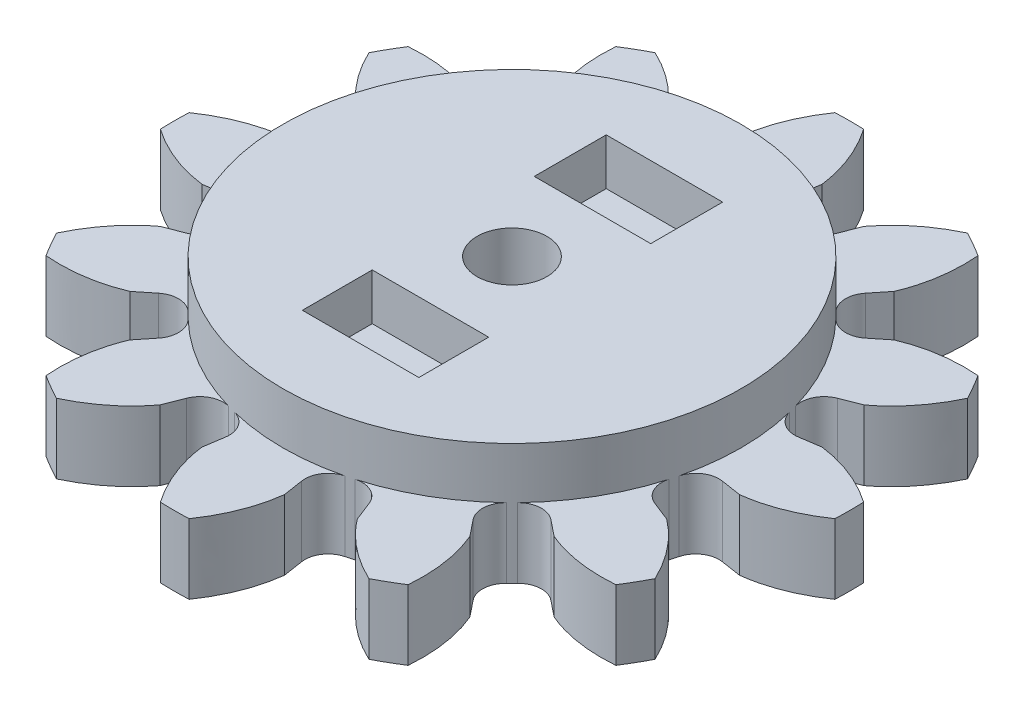
from build123d import *

# Parameters (mm, degrees)
SKETCH1_R           = 9.835
BOSS_EXTRUDE1_DEPTH = 5.2
BOSS_EXTRUDE2_DEPTH = 3
FILLET1_R           = 1
FILLET2_R           = 1
SKETCH3_R           = 1.5
CUT_EXTRUDE1_DEPTH  = 22.146231138
SKETCH4_W           = 5
SKETCH4_H           = 3.08895741
SKETCH4_H_2         = 3
CUT_EXTRUDE2_DEPTH  = 2


with BuildPart() as part:
    # Sketch1 → Boss-Extrude1 (new body)
    with BuildSketch(Plane(origin=(0, 0, 0), x_dir=(1, 0, 0), z_dir=(0, 1, 0))):
        with Locations(Location((0, 0, 0), (0, 0, 270))):
            Circle(SKETCH1_R)
    extrude(amount=BOSS_EXTRUDE1_DEPTH)

    # Sketch2 → Boss-Extrude2 (add)
    with BuildSketch(Plane.XZ):
        with BuildLine():
            Line((-1.490179603, -9.721449982), (-1.768790915, -11.539020112))
            add(Edge.make_bspline(
                [(-1.768790915, -11.539020112), (-1.641846644, -12.59558785), (-1.221344085, -13.608102781), (-0.616104691, -14.480399071)],
                knots=[0, 0, 0, 0, 1, 1, 1, 1], degree=3))
            ThreePointArc((-0.616104691, -14.480399071), (0, -14.4935), (0.616104691, -14.480399071))
            add(Edge.make_bspline(
                [(1.768790915, -11.539020112), (1.641846644, -12.59558785), (1.221344085, -13.608102781), (0.616104691, -14.480399071)],
                knots=[0, 0, 0, 0, 1, 1, 1, 1], degree=3))
            Line((1.768790915, -11.539020112), (1.490179603, -9.721449982))
            ThreePointArc((1.490179603, -9.721449982), (0, -9.835), (-1.490179603, -9.721449982))
        make_face()
        with BuildLine():
            Line((-3.570191598, -9.164112448), (-4.237692189, -10.877480009))
            add(Edge.make_bspline(
                [(-4.237692189, -10.877480009), (-4.875913022, -11.729022376), (-5.746336386, -12.395634748), (-6.706637222, -12.848445798)],
                knots=[0, 0, 0, 0, 1, 1, 1, 1], degree=3))
            ThreePointArc((-6.706637222, -12.848445798), (-7.24675, -12.55173919), (-7.773761849, -12.232341107))
            add(Edge.make_bspline(
                [(-7.301327922, -9.108689094), (-7.719674828, -10.087175732), (-7.861766395, -11.174290664), (-7.773761849, -12.232341107)],
                knots=[0, 0, 0, 0, 1, 1, 1, 1], degree=3))
            Line((-7.301327922, -9.108689094), (-6.151258383, -7.673932844))
            ThreePointArc((-6.151258383, -7.673932844), (-4.9175, -8.517359846), (-3.570191598, -9.164112448))
        make_face()
        with BuildLine():
            Line((-7.673932844, -6.151258383), (-9.108689094, -7.301327922))
            add(Edge.make_bspline(
                [(-9.108689094, -7.301327922), (-10.087175732, -7.719674828), (-11.174290664, -7.861766395), (-12.232341107, -7.773761849)],
                knots=[0, 0, 0, 0, 1, 1, 1, 1], degree=3))
            ThreePointArc((-12.232341107, -7.773761849), (-12.55173919, -7.24675), (-12.848445798, -6.706637222))
            add(Edge.make_bspline(
                [(-10.877480009, -4.237692189), (-11.729022376, -4.875913022), (-12.395634748, -5.746336386), (-12.848445798, -6.706637222)],
                knots=[0, 0, 0, 0, 1, 1, 1, 1], degree=3))
            Line((-10.877480009, -4.237692189), (-9.164112448, -3.570191598))
            ThreePointArc((-9.164112448, -3.570191598), (-8.517359846, -4.9175), (-7.673932844, -6.151258383))
        make_face()
        with BuildLine():
            Line((-9.721449982, -1.490179603), (-11.539020112, -1.768790915))
            add(Edge.make_bspline(
                [(-11.539020112, -1.768790915), (-12.59558785, -1.641846644), (-13.608102781, -1.221344085), (-14.480399071, -0.616104691)],
                knots=[0, 0, 0, 0, 1, 1, 1, 1], degree=3))
            ThreePointArc((-14.480399071, -0.616104691), (-14.4935, 0), (-14.480399071, 0.616104691))
            add(Edge.make_bspline(
                [(-11.539020112, 1.768790915), (-12.59558785, 1.641846644), (-13.608102781, 1.221344085), (-14.480399071, 0.616104691)],
                knots=[0, 0, 0, 0, 1, 1, 1, 1], degree=3))
            Line((-11.539020112, 1.768790915), (-9.721449982, 1.490179603))
            ThreePointArc((-9.721449982, 1.490179603), (-9.835, 0), (-9.721449982, -1.490179603))
        make_face()
        with BuildLine():
            Line((-9.164112448, 3.570191598), (-10.877480009, 4.237692189))
            add(Edge.make_bspline(
                [(-10.877480009, 4.237692189), (-11.729022376, 4.875913022), (-12.395634748, 5.746336386), (-12.848445798, 6.706637222)],
                knots=[0, 0, 0, 0, 1, 1, 1, 1], degree=3))
            ThreePointArc((-12.848445798, 6.706637222), (-12.55173919, 7.24675), (-12.232341107, 7.773761849))
            add(Edge.make_bspline(
                [(-9.108689094, 7.301327922), (-10.087175732, 7.719674828), (-11.174290664, 7.861766395), (-12.232341107, 7.773761849)],
                knots=[0, 0, 0, 0, 1, 1, 1, 1], degree=3))
            Line((-9.108689094, 7.301327922), (-7.673932844, 6.151258383))
            ThreePointArc((-7.673932844, 6.151258383), (-8.517359846, 4.9175), (-9.164112448, 3.570191598))
        make_face()
        with BuildLine():
            Line((-6.151258383, 7.673932844), (-7.301327922, 9.108689094))
            add(Edge.make_bspline(
                [(-7.301327922, 9.108689094), (-7.719674828, 10.087175732), (-7.861766395, 11.174290664), (-7.773761849, 12.232341107)],
                knots=[0, 0, 0, 0, 1, 1, 1, 1], degree=3))
            ThreePointArc((-7.773761849, 12.232341107), (-7.24675, 12.55173919), (-6.706637222, 12.848445798))
            add(Edge.make_bspline(
                [(-4.237692189, 10.877480009), (-4.875913022, 11.729022376), (-5.746336386, 12.395634748), (-6.706637222, 12.848445798)],
                knots=[0, 0, 0, 0, 1, 1, 1, 1], degree=3))
            Line((-4.237692189, 10.877480009), (-3.570191598, 9.164112448))
            ThreePointArc((-3.570191598, 9.164112448), (-4.9175, 8.517359846), (-6.151258383, 7.673932844))
        make_face()
        with BuildLine():
            Line((-1.490179603, 9.721449982), (-1.768790915, 11.539020112))
            add(Edge.make_bspline(
                [(-1.768790915, 11.539020112), (-1.641846644, 12.59558785), (-1.221344085, 13.608102781), (-0.616104691, 14.480399071)],
                knots=[0, 0, 0, 0, 1, 1, 1, 1], degree=3))
            ThreePointArc((-0.616104691, 14.480399071), (0, 14.4935), (0.616104691, 14.480399071))
            add(Edge.make_bspline(
                [(1.768790915, 11.539020112), (1.641846644, 12.59558785), (1.221344085, 13.608102781), (0.616104691, 14.480399071)],
                knots=[0, 0, 0, 0, 1, 1, 1, 1], degree=3))
            Line((1.768790915, 11.539020112), (1.490179603, 9.721449982))
            ThreePointArc((1.490179603, 9.721449982), (0, 9.835), (-1.490179603, 9.721449982))
        make_face()
        with BuildLine():
            Line((3.570191598, 9.164112448), (4.237692189, 10.877480009))
            add(Edge.make_bspline(
                [(4.237692189, 10.877480009), (4.875913022, 11.729022376), (5.746336386, 12.395634748), (6.706637222, 12.848445798)],
                knots=[0, 0, 0, 0, 1, 1, 1, 1], degree=3))
            ThreePointArc((6.706637222, 12.848445798), (7.24675, 12.55173919), (7.773761849, 12.232341107))
            add(Edge.make_bspline(
                [(7.301327922, 9.108689094), (7.719674828, 10.087175732), (7.861766395, 11.174290664), (7.773761849, 12.232341107)],
                knots=[0, 0, 0, 0, 1, 1, 1, 1], degree=3))
            Line((7.301327922, 9.108689094), (6.151258383, 7.673932844))
            ThreePointArc((6.151258383, 7.673932844), (4.9175, 8.517359846), (3.570191598, 9.164112448))
        make_face()
        with BuildLine():
            Line((7.673932844, 6.151258383), (9.108689094, 7.301327922))
            add(Edge.make_bspline(
                [(9.108689094, 7.301327922), (10.087175732, 7.719674828), (11.174290664, 7.861766395), (12.232341107, 7.773761849)],
                knots=[0, 0, 0, 0, 1, 1, 1, 1], degree=3))
            ThreePointArc((12.232341107, 7.773761849), (12.55173919, 7.24675), (12.848445798, 6.706637222))
            add(Edge.make_bspline(
                [(10.877480009, 4.237692189), (11.729022376, 4.875913022), (12.395634748, 5.746336386), (12.848445798, 6.706637222)],
                knots=[0, 0, 0, 0, 1, 1, 1, 1], degree=3))
            Line((10.877480009, 4.237692189), (9.164112448, 3.570191598))
            ThreePointArc((9.164112448, 3.570191598), (8.517359846, 4.9175), (7.673932844, 6.151258383))
        make_face()
        with BuildLine():
            Line((9.721449982, 1.490179603), (11.539020112, 1.768790915))
            add(Edge.make_bspline(
                [(11.539020112, 1.768790915), (12.59558785, 1.641846644), (13.608102781, 1.221344085), (14.480399071, 0.616104691)],
                knots=[0, 0, 0, 0, 1, 1, 1, 1], degree=3))
            ThreePointArc((14.480399071, 0.616104691), (14.4935, 0), (14.480399071, -0.616104691))
            add(Edge.make_bspline(
                [(11.539020112, -1.768790915), (12.59558785, -1.641846644), (13.608102781, -1.221344085), (14.480399071, -0.616104691)],
                knots=[0, 0, 0, 0, 1, 1, 1, 1], degree=3))
            Line((11.539020112, -1.768790915), (9.721449982, -1.490179603))
            ThreePointArc((9.721449982, -1.490179603), (9.835, 0), (9.721449982, 1.490179603))
        make_face()
        with BuildLine():
            Line((9.164112448, -3.570191598), (10.877480009, -4.237692189))
            add(Edge.make_bspline(
                [(10.877480009, -4.237692189), (11.729022376, -4.875913022), (12.395634748, -5.746336386), (12.848445798, -6.706637222)],
                knots=[0, 0, 0, 0, 1, 1, 1, 1], degree=3))
            ThreePointArc((12.848445798, -6.706637222), (12.55173919, -7.24675), (12.232341107, -7.773761849))
            add(Edge.make_bspline(
                [(9.108689094, -7.301327922), (10.087175732, -7.719674828), (11.174290664, -7.861766395), (12.232341107, -7.773761849)],
                knots=[0, 0, 0, 0, 1, 1, 1, 1], degree=3))
            Line((9.108689094, -7.301327922), (7.673932844, -6.151258383))
            ThreePointArc((7.673932844, -6.151258383), (8.517359846, -4.9175), (9.164112448, -3.570191598))
        make_face()
        with BuildLine():
            Line((6.151258383, -7.673932844), (7.301327922, -9.108689094))
            add(Edge.make_bspline(
                [(7.301327922, -9.108689094), (7.719674828, -10.087175732), (7.861766395, -11.174290664), (7.773761849, -12.232341107)],
                knots=[0, 0, 0, 0, 1, 1, 1, 1], degree=3))
            ThreePointArc((7.773761849, -12.232341107), (7.24675, -12.55173919), (6.706637222, -12.848445798))
            add(Edge.make_bspline(
                [(4.237692189, -10.877480009), (4.875913022, -11.729022376), (5.746336386, -12.395634748), (6.706637222, -12.848445798)],
                knots=[0, 0, 0, 0, 1, 1, 1, 1], degree=3))
            Line((4.237692189, -10.877480009), (3.570191598, -9.164112448))
            ThreePointArc((3.570191598, -9.164112448), (4.9175, -8.517359846), (6.151258383, -7.673932844))
        make_face()
    extrude(amount=-BOSS_EXTRUDE2_DEPTH)

    # Fillet1
    fillet1_edges = [part.edges().sort_by_distance(p)[0] for p in [
        (-1.490179603, 1.5, -9.721449982),
        (1.490179603, 1.5, -9.721449982),
    ]]
    fillet(fillet1_edges, radius=FILLET1_R)

    # Fillet2
    fillet2_edges = [part.edges().sort_by_distance(p)[0] for p in [
        (6.151258383, 1.5, 7.673932844),
        (3.570191598, 1.5, 9.164112448),
        (9.164112448, 1.5, 3.570191598),
        (7.673932844, 1.5, 6.151258383),
        (9.721449982, 1.5, -1.490179603),
        (9.721449982, 1.5, 1.490179603),
        (7.673932844, 1.5, -6.151258383),
        (9.164112448, 1.5, -3.570191598),
        (3.570191598, 1.5, -9.164112448),
        (6.151258383, 1.5, -7.673932844),
        (-6.151258383, 1.5, -7.673932844),
        (-3.570191598, 1.5, -9.164112448),
        (-9.164112448, 1.5, -3.570191598),
        (-7.673932844, 1.5, -6.151258383),
        (-9.721449982, 1.5, 1.490179603),
        (-9.721449982, 1.5, -1.490179603),
        (-7.673932844, 1.5, 6.151258383),
        (-9.164112448, 1.5, 3.570191598),
        (-3.570191598, 1.5, 9.164112448),
        (-6.151258383, 1.5, 7.673932844),
        (1.490179603, 1.5, 9.721449982),
        (-1.490179603, 1.5, 9.721449982),
    ]]
    fillet(fillet2_edges, radius=FILLET2_R)

    # Sketch3 → Cut-Extrude1 (cut, through all)
    with BuildSketch(Plane(origin=(0, 5.2, 0), x_dir=(1, 0, 0), z_dir=(0, 1, 0))):
        with Locations(Location((0, 0, 0), (0, 0, 270))):
            Circle(SKETCH3_R)
    extrude(amount=-CUT_EXTRUDE1_DEPTH, mode=Mode.SUBTRACT)

    # Sketch4 → Cut-Extrude2 (cut)
    with BuildSketch(Plane(origin=(0, 5.2, 0), x_dir=(1, 0, 0), z_dir=(0, 1, 0))):
        with Locations((0, 5)):
            Rectangle(SKETCH4_W, SKETCH4_H)
        with Locations((0, -5)):
            Rectangle(SKETCH4_W, SKETCH4_H_2)
    extrude(amount=-CUT_EXTRUDE2_DEPTH, mode=Mode.SUBTRACT)


solid = part.part
